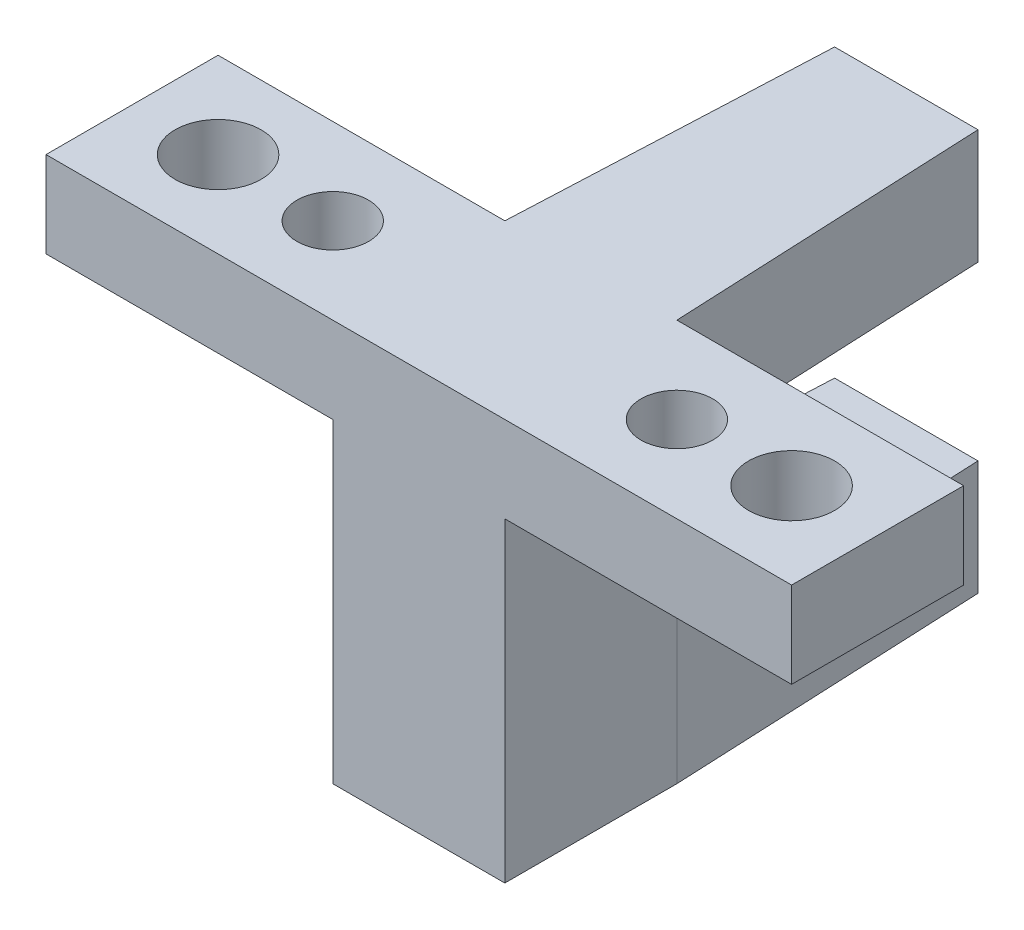
from build123d import *

# Parameters (mm, degrees)
SKETCH_1_W      = 26
SKETCH_1_H      = 6
SKETCH_1_R      = 1.5
SKETCH_1_R_2    = 1.25
EXTRUDE_1_DEPTH = 3
EXTRUDE_2_DEPTH = 4
EXTRUDE_3_DEPTH = 11
EXTRUDE_4_DEPTH = 4


with BuildPart() as part:
    # 草图1 → 凸台-拉伸1 (new body)
    with BuildSketch(Plane(origin=(0, 0, 0), x_dir=(1, 0, 0), z_dir=(0, 1, 0))):
        Rectangle(SKETCH_1_W, SKETCH_1_H)
        with Locations(Location((-10, 0, 0), (0, 0, 270))):
            Circle(SKETCH_1_R, mode=Mode.SUBTRACT)
        with Locations(Location((-6, 0, 0), (0, 0, 270))):
            Circle(SKETCH_1_R_2, mode=Mode.SUBTRACT)
        with Locations(Location((10, 0, 0), (0, 0, 270))):
            Circle(SKETCH_1_R, mode=Mode.SUBTRACT)
        with Locations(Location((6, 0, 0), (0, 0, 270))):
            Circle(SKETCH_1_R_2, mode=Mode.SUBTRACT)
    extrude(amount=EXTRUDE_1_DEPTH)

    # 草图2 → 凸台-拉伸2 (add)
    with BuildSketch(Plane(origin=(0, 3, 0), x_dir=(1, 0, 0), z_dir=(0, 1, 0))):
        Polygon((0, 14), (0, 3), (3, 3), (2.5, 14), align=None)
        Polygon((-3, 3), (0, 3), (0, 14), (-2.5, 14), align=None)
    extrude(amount=-EXTRUDE_2_DEPTH)

    # 草图3 → 凸台-拉伸3 (add)
    with BuildSketch(Plane.XZ):
        Polygon((2.818181818, -7), (3, -3), (0, -3), (0, -7), align=None)
        Polygon((0, -3), (-3, -3), (-2.818181818, -7), (0, -7), align=None)
        Polygon((3, 3), (-3, 3), (-3, -3), (0, -3), (3, -3), align=None)
    extrude(amount=EXTRUDE_3_DEPTH)

    # 草图4 → 凸台-拉伸4 (add)
    with BuildSketch(Plane.XZ.offset(11)):
        Polygon((-2.5, -14), (2.5, -14), (2.818181818, -7), (-2.818181818, -7), align=None)
    extrude(amount=-EXTRUDE_4_DEPTH)


solid = part.part
